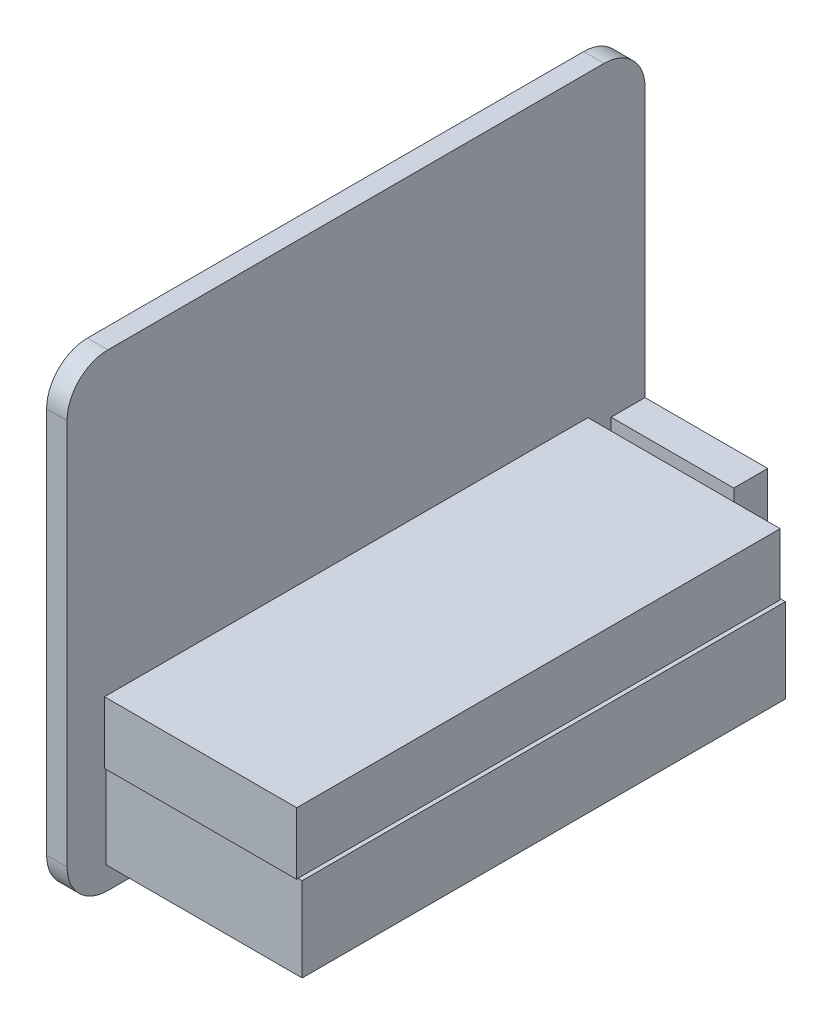
from build123d import *

# Parameters (mm, degrees)
BOSS_EXTRUDE1_DEPTH = 5
SKETCH2_W           = 118.181462396
SKETCH2_H           = 15.165331065
BOSS_EXTRUDE4_DEPTH = 47
SKETCH3_W           = 118.126380902
SKETCH3_H           = 20.616541225
BOSS_EXTRUDE5_DEPTH = 48
SKETCH4_W           = 8.296758782
SKETCH4_H           = 26.299414598
BOSS_EXTRUDE6_DEPTH = 30
CUT_EXTRUDE3_DEPTH  = 7
SKETCH6_W           = 2.21745904
SKETCH6_H           = 1.840019648
SKETCH6_W_2         = 2.568509623
SKETCH6_W_3         = 2.623522206
SKETCH6_H_2         = 1.802097087
BOSS_EXTRUDE7_DEPTH = 7


with BuildPart() as part:
    # Sketch1 → Boss-Extrude1 (new body)
    with BuildSketch(Plane(origin=(0, 0, 0), x_dir=(0, 0, -1), z_dir=(1, 0, 0))):
        with BuildLine():
            Line((10, 0), (131.29221645, 0))
            ThreePointArc((131.29221645, 0), (138.363284262, -2.928932188), (141.29221645, -10))
            Line((141.29221645, -10), (141.29221645, -104.488481637))
            ThreePointArc((141.29221645, -104.488481637), (138.363284262, -111.559549449), (131.29221645, -114.488481637))
            Line((131.29221645, -114.488481637), (10, -114.488481637))
            ThreePointArc((10, -114.488481637), (2.928932188, -111.559549449), (0, -104.488481637))
            Line((0, -104.488481637), (0, -10))
            ThreePointArc((0, -10), (2.928932188, -2.928932188), (10, 0))
        make_face()
    extrude(amount=BOSS_EXTRUDE1_DEPTH)

    # Sketch2 → Boss-Extrude4 (add)
    with BuildSketch(Plane(origin=(5, 0, 0), x_dir=(0, 0, -1), z_dir=(1, 0, 0))):
        with Locations((68.242208416, -80.606538465)):
            Rectangle(SKETCH2_W, SKETCH2_H)
    extrude(amount=BOSS_EXTRUDE4_DEPTH)

    # Sketch3 → Boss-Extrude5 (add)
    with BuildSketch(Plane(origin=(5, 0, 0), x_dir=(0, 0, -1), z_dir=(1, 0, 0))):
        with Locations((68.5485811, -98.427462894)):
            Rectangle(SKETCH3_W, SKETCH3_H)
    extrude(amount=BOSS_EXTRUDE5_DEPTH)

    # Sketch4 → Boss-Extrude6 (add)
    with BuildSketch(Plane(origin=(5, 0, 0), x_dir=(0, 0, -1), z_dir=(1, 0, 0))):
        with Locations((137.143837059, -88.907539255)):
            Rectangle(SKETCH4_W, SKETCH4_H)
    extrude(amount=BOSS_EXTRUDE6_DEPTH)

    # Sketch5 → Cut-Extrude3 (cut)
    with BuildSketch(Plane(origin=(0, 0, -141.29221645), x_dir=(-1, 0, 0), z_dir=(0, 0, -1))):
        Polygon((-25.464332728, -97.926181685), (-12.810425415, -97.926181685), (-8.73119877, -90.234247578), (-8.73119877, -80.275506322), (-31.116096198, -80.275506322), (-31.116096198, -91.525760494), align=None)
    extrude(amount=-CUT_EXTRUDE3_DEPTH, mode=Mode.SUBTRACT)

    # Sketch6 → Boss-Extrude7 (add)
    with BuildSketch(Plane(origin=(0, 0, -134.29221645), x_dir=(-1, 0, 0), z_dir=(0, 0, -1))):
        with Locations((-25.041507493, -87.601540864)):
            Rectangle(SKETCH6_W, SKETCH6_H)
        with Locations((-13.458219738, -87.601540864)):
            Rectangle(SKETCH6_W_2, SKETCH6_H)
        with Locations((-19.506551217, -92.8677498)):
            Rectangle(SKETCH6_W_3, SKETCH6_H_2)
    extrude(amount=BOSS_EXTRUDE7_DEPTH)


solid = part.part
